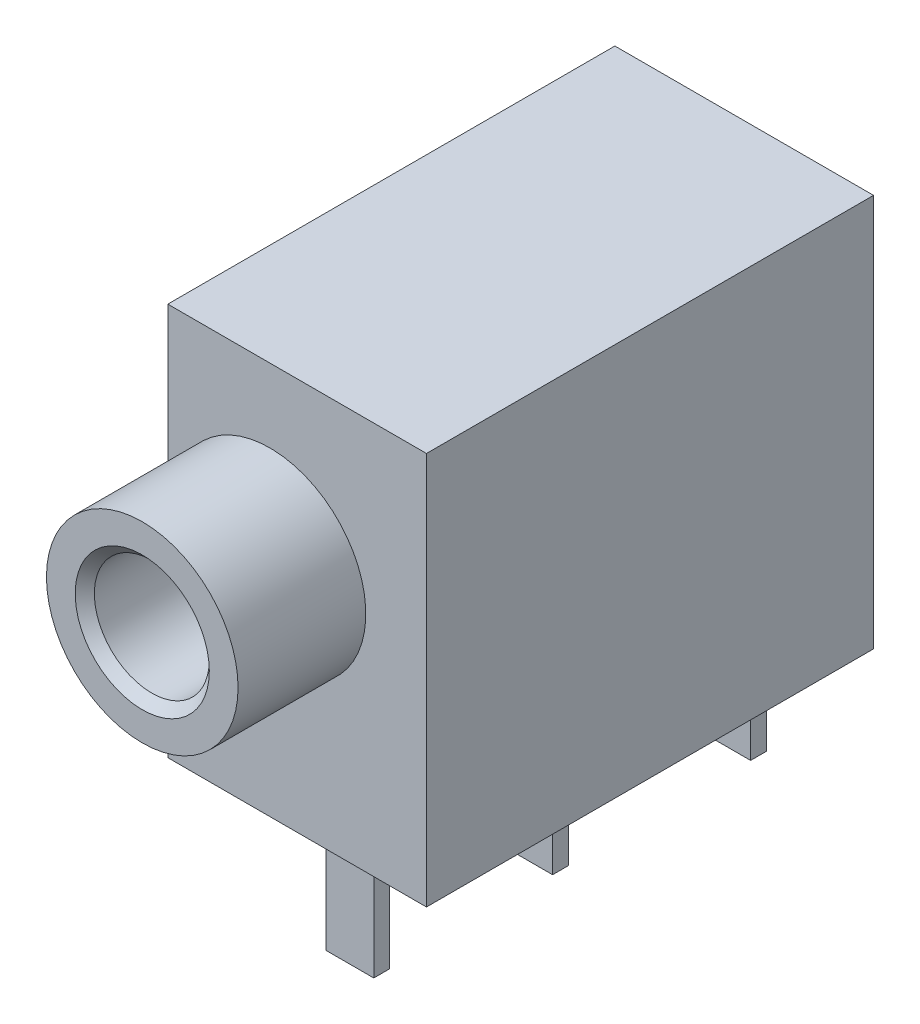
from build123d import *

# Parameters (mm, degrees)
SKETCH1_W           = 8.1
SKETCH1_H           = 12.3
BOSS_EXTRUDE1_DEPTH = 7
SKETCH2_R           = 3
BOSS_EXTRUDE2_DEPTH = 4
SKETCH3_R           = 1.8
CUT_EXTRUDE1_DEPTH  = 14
CHAMFER1_SIZE       = 0.3
SKETCH4_W           = 1.5
SKETCH4_H           = 0.5
BOSS_EXTRUDE3_DEPTH = 3.5


with BuildPart() as part:
    # Sketch1 → Boss-Extrude1 (new, symmetric)
    with BuildSketch(Plane.XY):
        Rectangle(SKETCH1_W, SKETCH1_H)
    extrude(amount=BOSS_EXTRUDE1_DEPTH, both=True)

    # Sketch2 → Boss-Extrude2 (add)
    with BuildSketch(Plane.XY.offset(7)):
        with Locations(Location((-0.85, 0.85, 0), (0, 0, 180))):
            Circle(SKETCH2_R)
    extrude(amount=BOSS_EXTRUDE2_DEPTH)

    # Sketch3 → Cut-Extrude1 (cut)
    with BuildSketch(Plane.XY.offset(11)):
        with Locations((-0.85, 0.85)):
            Circle(SKETCH3_R)
    extrude(amount=-CUT_EXTRUDE1_DEPTH, mode=Mode.SUBTRACT)

    # Chamfer1
    chamfer1_edges = [part.edges().sort_by_distance(p)[0] for p in [
        (-2.65, 0.85, 11),
    ]]
    chamfer(chamfer1_edges, length=CHAMFER1_SIZE)

    # Sketch4 → Boss-Extrude3 (add)
    with BuildSketch(Plane.XZ.offset(6.15)):
        with Locations((0.9, 6)):
            Rectangle(SKETCH4_W, SKETCH4_H)
        with Locations((-1.1, 2.3)):
            Rectangle(SKETCH4_W, SKETCH4_H)
        with Locations((0.9, 0.4)):
            Rectangle(SKETCH4_W, SKETCH4_H)
        with Locations((-1.1, -3.3)):
            Rectangle(SKETCH4_W, SKETCH4_H)
        with Locations((0.9, -5.8)):
            Rectangle(SKETCH4_W, SKETCH4_H)
    extrude(amount=BOSS_EXTRUDE3_DEPTH)


solid = part.part
